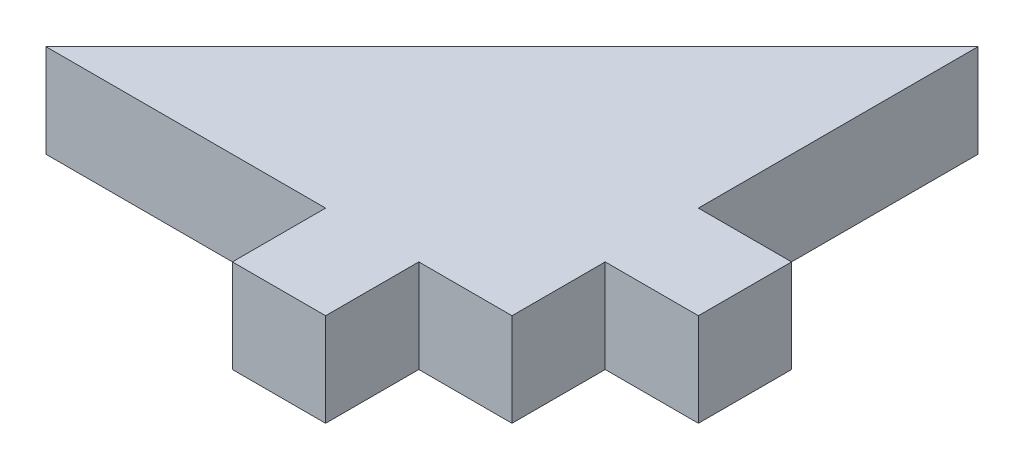
from build123d import *

# Parameters (mm, degrees)
BOSS_EXTRUDE1_DEPTH = 2.54
SKETCH2_W           = 2.54
SKETCH2_H           = 2.54
BOSS_EXTRUDE2_DEPTH = 2.54


with BuildPart() as part:
    # Sketch1 → Boss-Extrude1 (new body)
    with BuildSketch(Plane(origin=(0, 0, 0), x_dir=(1, 0, 0), z_dir=(0, 1, 0))):
        Polygon((0, 0), (0, 12.7), (-12.7, 0), align=None)
    extrude(amount=BOSS_EXTRUDE1_DEPTH)

    # Sketch2 → Boss-Extrude2 (add)
    with BuildSketch(Plane(origin=(0, 2.54, 0), x_dir=(1, 0, 0), z_dir=(0, 1, 0))):
        with Locations((-3.81, -1.27)):
            Rectangle(SKETCH2_W, SKETCH2_H)
        with Locations((1.27, 3.81)):
            Rectangle(SKETCH2_W, SKETCH2_H)
    extrude(amount=-BOSS_EXTRUDE2_DEPTH)


solid = part.part
